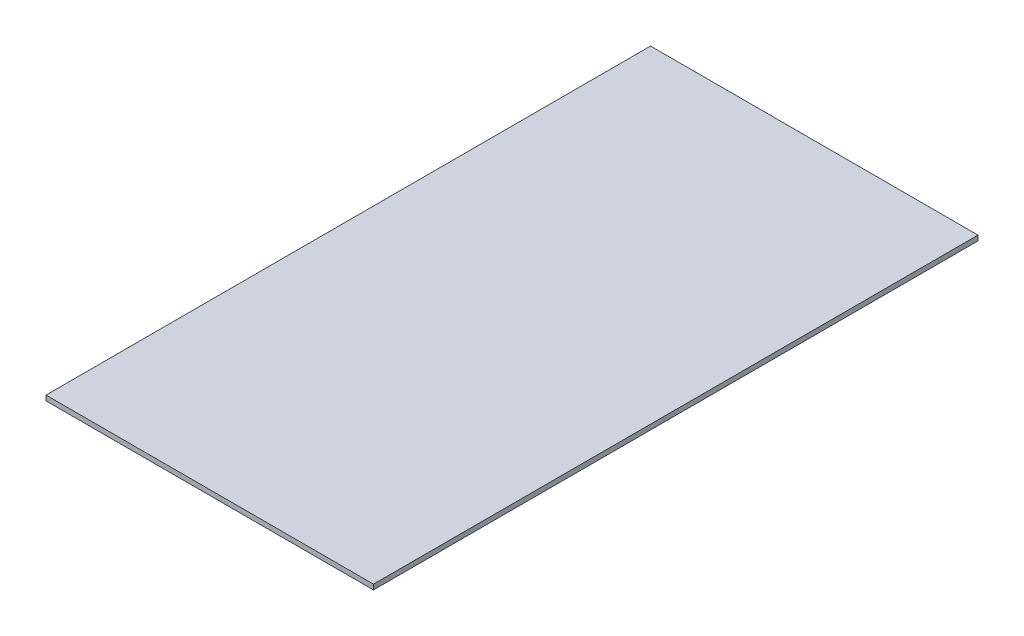
from build123d import *

# Parameters (mm, degrees)
SKETCH1_W           = 65
SKETCH1_H           = 120
BOSS_EXTRUDE1_DEPTH = 1


with BuildPart() as part:
    # Sketch1 → Boss-Extrude1 (new body)
    with BuildSketch(Plane(origin=(0, 0, 0), x_dir=(1, 0, 0), z_dir=(0, 1, 0))):
        Rectangle(SKETCH1_W, SKETCH1_H)
    extrude(amount=BOSS_EXTRUDE1_DEPTH)


solid = part.part
